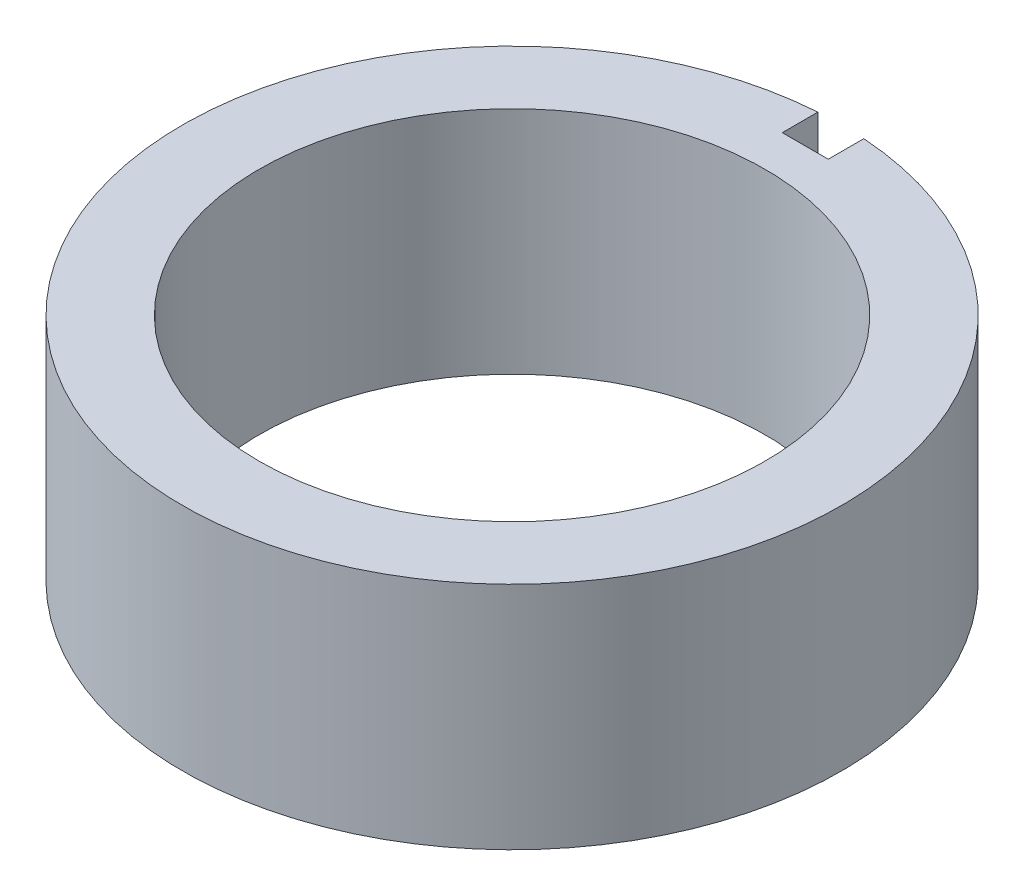
from build123d import *

# Parameters (mm, degrees)
SKETCH1_R           = 33
BOSS_EXTRUDE1_DEPTH = 30


with BuildPart() as part:
    # Sketch1 → Boss-Extrude1 (new body)
    with BuildSketch(Plane(origin=(0, 0, 0), x_dir=(1, 0, 0), z_dir=(0, 1, 0))):
        with BuildLine():
            Line((-3, 42.895221179), (-3, 38.251687421))
            Line((-3, 38.251687421), (3, 38.251687421))
            Line((3, 38.251687421), (3, 42.895221179))
            ThreePointArc((3, 42.895221179), (0, -43), (-3, 42.895221179))
        make_face()
        with Locations(Location((0, 0, 0), (0, 0, 270))):
            Circle(SKETCH1_R, mode=Mode.SUBTRACT)
    extrude(amount=BOSS_EXTRUDE1_DEPTH)


solid = part.part
